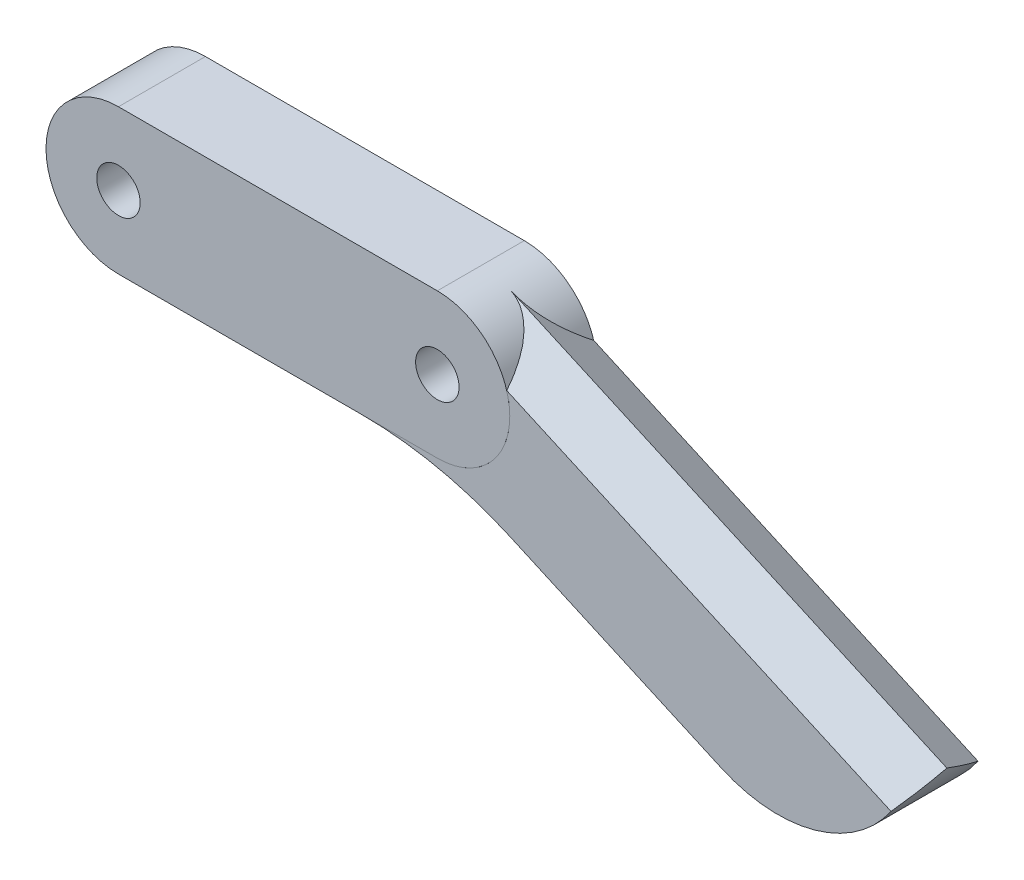
from build123d import *

# Parameters (mm, degrees)
SKETCH_1_R      = 1.5
EXTRUDE_1_DEPTH = 6
EXTRUDE_2_DEPTH = 6


with BuildPart() as part:
    # 草图1 → 凸台-拉伸1 (new body)
    with BuildSketch(Plane.XY):
        with BuildLine():
            Line((-11, 5), (11, 5))
            ThreePointArc((11, 5), (16, 0), (11, -5))
            Line((11, -5), (-11, -5))
            ThreePointArc((-11, -5), (-16, 0), (-11, 5))
        make_face()
        with Locations((-11, 0)):
            Circle(SKETCH_1_R, mode=Mode.SUBTRACT)
        with Locations((11, 0)):
            Circle(SKETCH_1_R, mode=Mode.SUBTRACT)
    extrude(amount=EXTRUDE_1_DEPTH)


with BuildPart() as body_2:
    # 草图2 → 凸台-拉伸2 (new body)
    with BuildSketch(Plane.XY.offset(6)):
        with BuildLine():
            Line((30.602691257, -13.719857707), (16.032361282, -7.187659205))
            ThreePointArc((16.032361282, -7.187659205), (11.034404004, -5.553031682), (5.805088555, -5))
            Line((5.805088555, -5), (11, -5))
            ThreePointArc((11, -5), (15.889393664, -1.04586309), (13.045454545, 4.562468159))
            Line((13.045454545, 4.562468159), (34.945301709, -5.255713659))
            Line((34.945301709, -5.255713659), (43.157744395, -8.937531841))
            ThreePointArc((43.157744395, -8.937531841), (37.870669943, -13.928931417), (30.602691257, -13.719857707))
        make_face()
    extrude(amount=-EXTRUDE_2_DEPTH)

    # Surface Cut 1
    split(bisect_by=Plane(origin=(2.383348048, 5.316153128, -3.363620668), x_dir=(0.9124936318129424, -0.40909090909090917, 0), z_dir=(0.35428311972999815, 0.7902426659415334, -0.499999999999998)), keep=Keep.BOTTOM)

    # Surface Cut 2
    split(bisect_by=Plane(origin=(3.446197407, 7.686881126, 4.863620668), x_dir=(0.9124936318129424, -0.40909090909090917, 0), z_dir=(0.35428311972999815, 0.7902426659415334, 0.499999999999998)), keep=Keep.BOTTOM)


solid = Compound([part.part, body_2.part])
